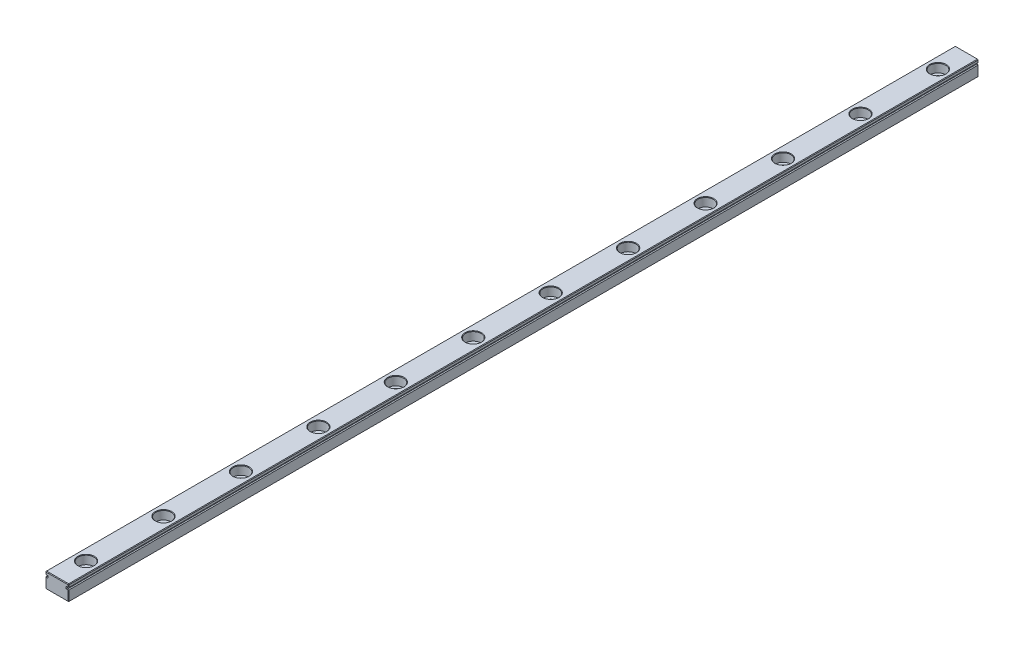
from build123d import *

# Parameters (mm, degrees)
BOSS_EXTRUDE1_DEPTH = 470
CHAMFER1_SIZE       = 0.3
LPATTERN1_COUNT     = 12
LPATTERN1_PITCH     = 40


with BuildPart() as part:
    # Sketch1 → Boss-Extrude1 (new body)
    with BuildSketch(Plane.XY):
        with BuildLine():
            Line((0, 8), (12, 8))
            Line((12, 8), (12, 6.75))
            Line((12, 6.75), (12, 6.559016994))
            ThreePointArc((12, 6.559016994), (11.706107374, 6.475528258), (11.5, 6.25))
            Line((11.5, 6.25), (11, 6.25))
            Line((11, 6.25), (11, 5.75))
            Line((11, 5.75), (11.5, 5.75))
            ThreePointArc((11.5, 5.75), (11.706107374, 5.524471742), (12, 5.440983006))
            Line((12, 5.440983006), (12, 5.25))
            Line((12, 5.25), (12, 0))
            Line((12, 0), (0, 0))
            Line((0, 0), (0, 5.25))
            Line((0, 5.25), (0, 5.440983006))
            ThreePointArc((0, 5.440983006), (0.293892626, 5.524471742), (0.5, 5.75))
            Line((0.5, 5.75), (1, 5.75))
            Line((1, 5.75), (1, 6.25))
            Line((1, 6.25), (0.5, 6.25))
            ThreePointArc((0.5, 6.25), (0.293892626, 6.475528258), (0, 6.559016994))
            Line((0, 6.559016994), (0, 6.75))
            Line((0, 6.75), (0, 8))
        make_face()
    extrude(amount=BOSS_EXTRUDE1_DEPTH)

    # Chamfer1
    chamfer1_edges = [part.edges().sort_by_distance(p)[0] for p in [
        (12, 2.720491503, 470),
        (11.706107374, 5.524471742, 470),
        (0, 2.720491503, 0),
        (0.293892626, 5.524471742, 0),
        (0.75, 5.75, 0),
        (1, 6, 0),
        (0.75, 6.25, 0),
        (11.25, 5.75, 470),
        (0.293892626, 6.475528258, 0),
        (0, 7.279508497, 0),
        (6, 8, 0),
        (12, 7.279508497, 0),
        (11.706107374, 6.475528258, 0),
        (11, 6, 470),
        (11.25, 6.25, 0),
        (11, 6, 0),
        (11.25, 5.75, 0),
        (11.706107374, 5.524471742, 0),
        (12, 2.720491503, 0),
        (6, 0, 0),
        (11.25, 6.25, 470),
        (11.706107374, 6.475528258, 470),
        (12, 7.279508497, 470),
        (0, 8, 235),
        (12, 8, 235),
        (12, 0, 235),
        (0, 0, 235),
        (6, 8, 470),
        (0, 2.720491503, 470),
        (0, 7.279508497, 470),
        (0.293892626, 6.475528258, 470),
        (0.75, 6.25, 470),
        (1, 6, 470),
        (0.75, 5.75, 470),
        (0.293892626, 5.524471742, 470),
        (6, 0, 470),
    ]]
    chamfer(chamfer1_edges, length=CHAMFER1_SIZE)

    # Sketch3 → CBORE for M5 Hex Head Bolt1 (revolve, cut)
    with BuildSketch(Plane(origin=(6, 8, 15), x_dir=(0, 0, 1), z_dir=(1, 0, 0))):
        Polygon((0, 0), (0, 8), (2.5, 8), (2.25, 7.75), (2.25, 4.5), (4, 4.5), (4, 0.25), (4.25, 0), align=None)
    cbore_for_m5_hex_head_bolt1 = revolve(axis=Axis((6, 14.35, 15), (0, -1, 0)), mode=Mode.SUBTRACT)

    # LPattern1: CBORE for M5 Hex Head Bolt1 ×12
    with Locations(*[(0, 0, i * LPATTERN1_PITCH) for i in range(1, LPATTERN1_COUNT)]):
        add(cbore_for_m5_hex_head_bolt1, mode=Mode.SUBTRACT)


solid = part.part
